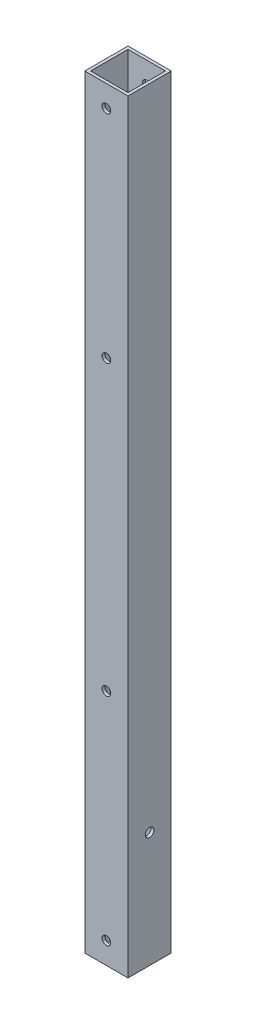
from build123d import *

# Parameters (mm, degrees)
SKETCH_1_W          = 15
SKETCH_1_H          = 15
SKETCH_1_W_2        = 13
SKETCH_1_H_2        = 13
EXTRUDE_1_DEPTH     = 265
SKETCH_2_R          = 1.5
CUT_EXTRUDE_1_DEPTH = 266.530130117
SKETCH_3_R          = 1.5
CUT_EXTRUDE_2_DEPTH = 266.530130117


with BuildPart() as part:
    # 草图1 → 凸台-拉伸1 (new body)
    with BuildSketch(Plane(origin=(0, 0, 0), x_dir=(1, 0, 0), z_dir=(0, 1, 0))):
        Rectangle(SKETCH_1_W, SKETCH_1_H)
        Rectangle(SKETCH_1_W_2, SKETCH_1_H_2, mode=Mode.SUBTRACT)
    extrude(amount=EXTRUDE_1_DEPTH)

    # 草图2 → 切除-拉伸1 (cut, through all)
    with BuildSketch(Plane.XY.offset(7.5)):
        with Locations((0, 7.5)):
            Circle(SKETCH_2_R)
        with Locations((0, 257.5)):
            Circle(SKETCH_2_R)
        with Locations((0, 182.5)):
            Circle(SKETCH_2_R)
        with Locations((0, 82.5)):
            Circle(SKETCH_2_R)
    extrude(amount=-CUT_EXTRUDE_1_DEPTH, mode=Mode.SUBTRACT)

    # 草图3 → 切除-拉伸2 (cut, through all)
    with BuildSketch(Plane(origin=(7.5, 0, 0), x_dir=(0, 0, -1), z_dir=(1, 0, 0))):
        with Locations((0, 40)):
            Circle(SKETCH_3_R)
    extrude(amount=-CUT_EXTRUDE_2_DEPTH, mode=Mode.SUBTRACT)


solid = part.part
